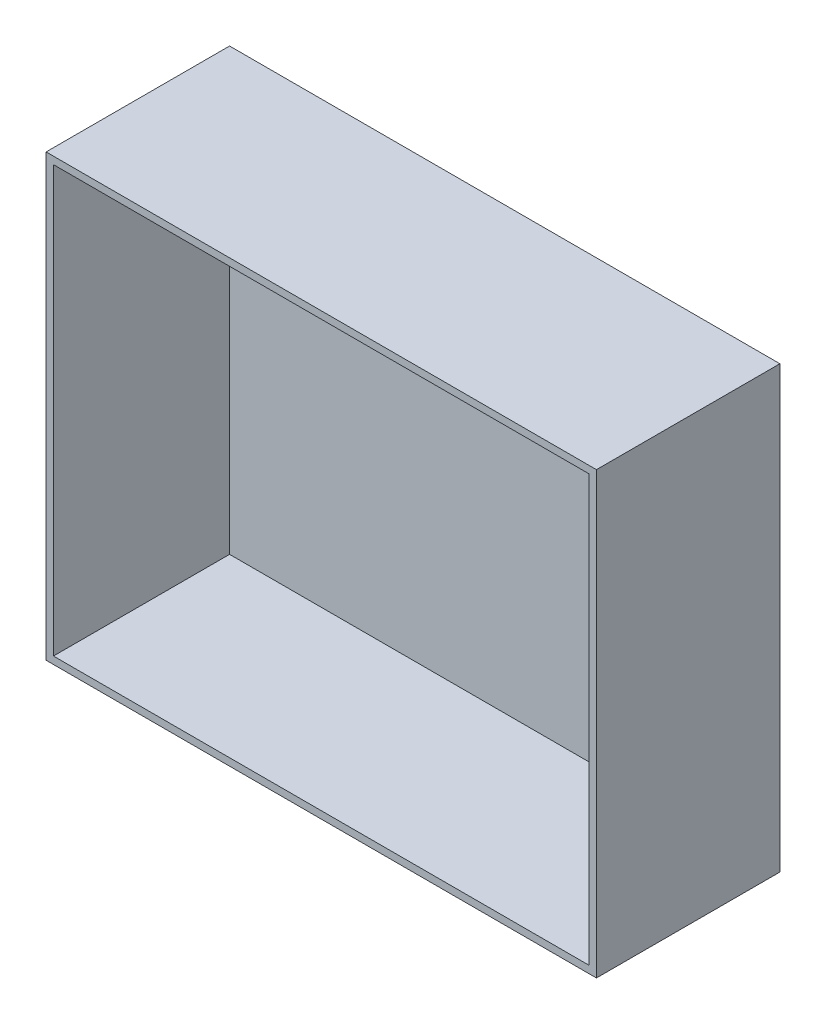
from build123d import *

# Parameters (mm, degrees)
SKETCH1_W           = 150
SKETCH1_H           = 120
BOSS_EXTRUDE1_DEPTH = 25
SHELL1_T            = -2


with BuildPart() as part:
    # Sketch1 → Boss-Extrude1 (new, symmetric)
    with BuildSketch(Plane.XY):
        Rectangle(SKETCH1_W, SKETCH1_H)
    extrude(amount=BOSS_EXTRUDE1_DEPTH, both=True)

    # Shell1
    shell1_openings = [part.faces().sort_by_distance(p)[0] for p in [
        (0, 0, 25),
    ]]
    offset(amount=SHELL1_T, openings=shell1_openings, kind=Kind.INTERSECTION)


solid = part.part
